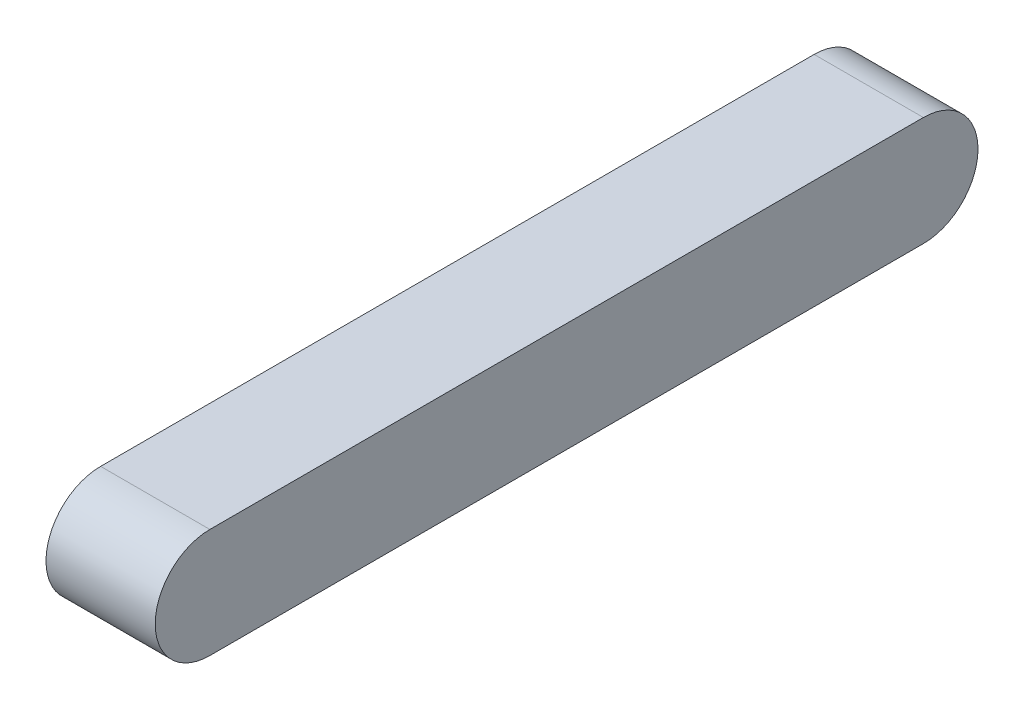
from build123d import *

# Parameters (mm, degrees)
SZKIC1_W                    = 4.78
SZKIC1_H                    = 4.78
DODANIE_WYCI_GNI_CIE1_DEPTH = 36
ZAOKR_GLENIE1_RADIUS        = 2.39
ZAOKR_GLENIE1_LENGTH        = 4.78
ZAOKR_GLENIE2_RADIUS        = 2.39
ZAOKR_GLENIE2_LENGTH        = 4.78


with BuildPart() as part:
    # Szkic1 → Dodanie-wyciągnięcie1 (new body)
    with BuildSketch(Plane.XY):
        Rectangle(SZKIC1_W, SZKIC1_H)
    extrude(amount=DODANIE_WYCI_GNI_CIE1_DEPTH)

    # Zaokrąglenie1: full round fillet: the end face becomes a half cylinder, R = half its width
    zaokr_glenie1_face = Plane((0, 0, 36), x_dir=(-1, 0, 0), z_dir=(0, 0, 1))  # on the end face: x along it, z out of the body
    zaokr_glenie1_slab = zaokr_glenie1_face.offset(-ZAOKR_GLENIE1_RADIUS / 2) * Box(ZAOKR_GLENIE1_LENGTH, 2 * ZAOKR_GLENIE1_RADIUS, ZAOKR_GLENIE1_RADIUS, mode=Mode.PRIVATE)  # the body's end, R deep
    zaokr_glenie1_round = Plane((0, 0, 33.61), x_dir=(0, 0, 1), z_dir=(-1, 0, 0)) * Cylinder(ZAOKR_GLENIE1_RADIUS, ZAOKR_GLENIE1_LENGTH, mode=Mode.PRIVATE)  # its axis R under the face
    add(zaokr_glenie1_slab - zaokr_glenie1_round, mode=Mode.SUBTRACT)

    # Zaokrąglenie2: full round fillet: the end face becomes a half cylinder, R = half its width
    zaokr_glenie2_face = Plane((0, 0, 0), x_dir=(1, 0, 0), z_dir=(0, 0, -1))  # on the end face: x along it, z out of the body
    zaokr_glenie2_slab = zaokr_glenie2_face.offset(-ZAOKR_GLENIE2_RADIUS / 2) * Box(ZAOKR_GLENIE2_LENGTH, 2 * ZAOKR_GLENIE2_RADIUS, ZAOKR_GLENIE2_RADIUS, mode=Mode.PRIVATE)  # the body's end, R deep
    zaokr_glenie2_round = Plane((0, 0, 2.39), x_dir=(0, 0, -1), z_dir=(1, 0, 0)) * Cylinder(ZAOKR_GLENIE2_RADIUS, ZAOKR_GLENIE2_LENGTH, mode=Mode.PRIVATE)  # its axis R under the face
    add(zaokr_glenie2_slab - zaokr_glenie2_round, mode=Mode.SUBTRACT)


solid = part.part
